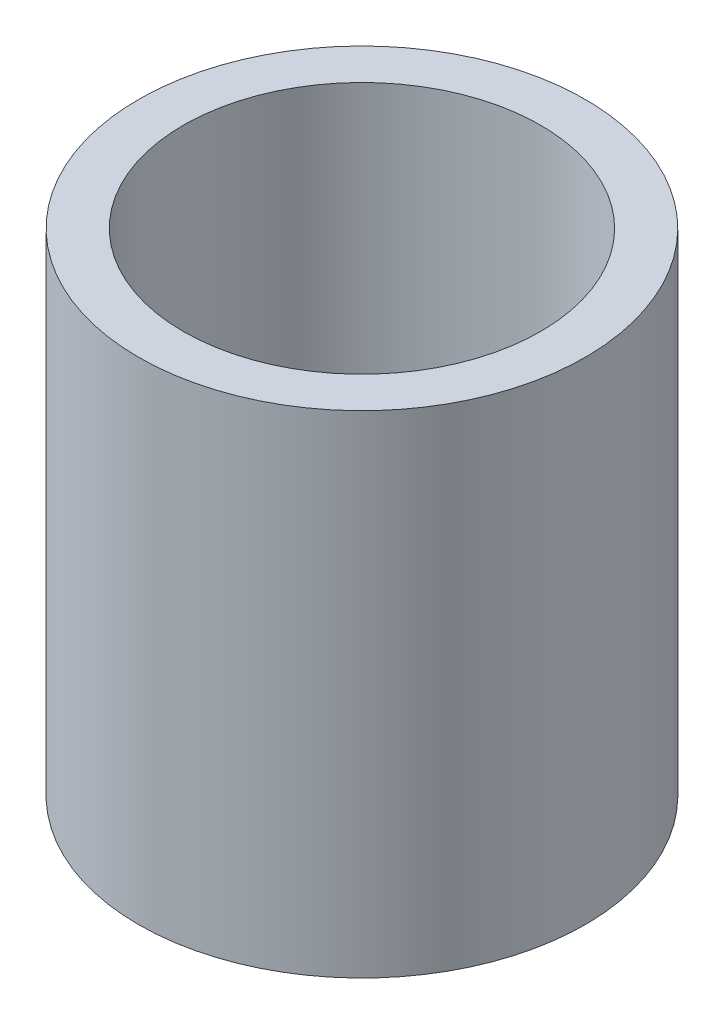
from build123d import *

# Parameters (mm, degrees)
SKETCH1_R           = 0.625
SKETCH1_R_2         = 0.5
BOSS_EXTRUDE1_DEPTH = 1.375


with BuildPart() as part:
    # Sketch1 → Boss-Extrude1 (new body)
    with BuildSketch(Plane(origin=(0, 0, 0), x_dir=(1, 0, 0), z_dir=(0, 1, 0))):
        with Locations(Location((0, 0, 0), (0, 0, 270))):
            Circle(SKETCH1_R)
        with Locations(Location((0, 0, 0), (0, 0, 270))):
            Circle(SKETCH1_R_2, mode=Mode.SUBTRACT)
    extrude(amount=BOSS_EXTRUDE1_DEPTH)


solid = part.part
